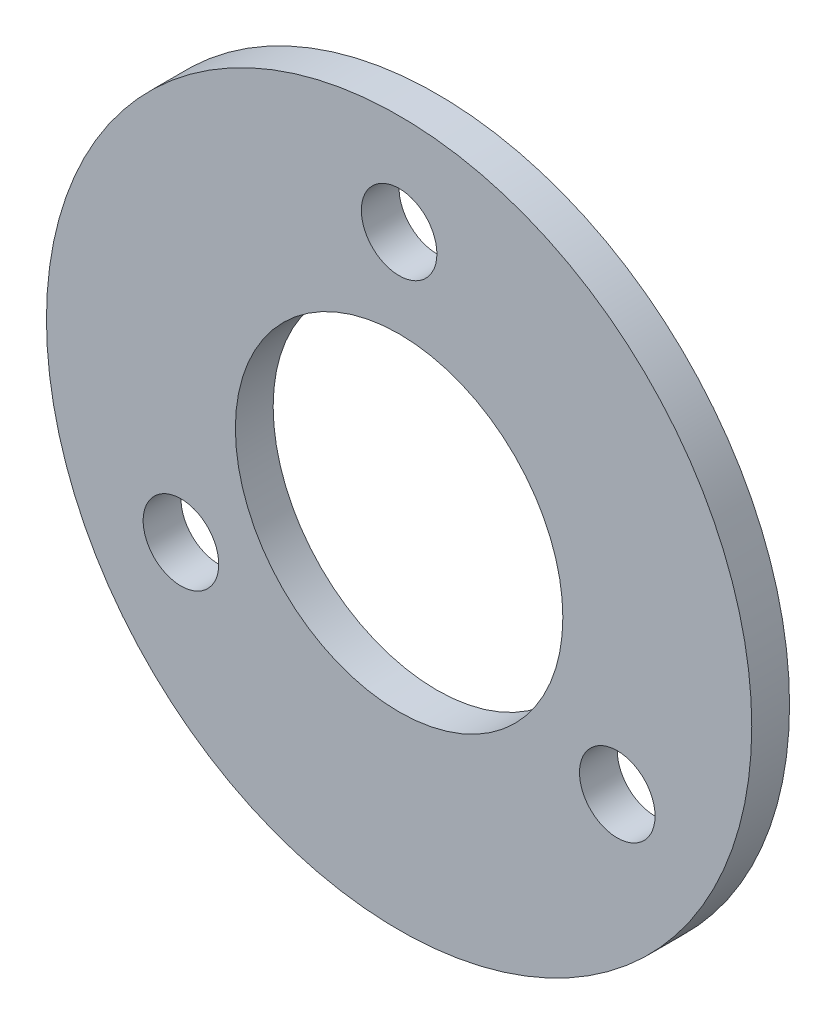
from build123d import *

# Parameters (mm, degrees)
ESBO_O1_R                = 14
ESBO_O1_R_2              = 1.5
ESBO_O1_R_3              = 6.5
RESSALTO_EXTRUS_O1_DEPTH = 1.5


with BuildPart() as part:
    # Esboço1 → Ressalto-extrusão1 (new body)
    with BuildSketch(Plane.XY):
        Circle(ESBO_O1_R)
        with Locations((-8.660254038, -5)):
            Circle(ESBO_O1_R_2, mode=Mode.SUBTRACT)
        with Locations((8.660254038, -5)):
            Circle(ESBO_O1_R_2, mode=Mode.SUBTRACT)
        with Locations((0, 10)):
            Circle(ESBO_O1_R_2, mode=Mode.SUBTRACT)
        Circle(ESBO_O1_R_3, mode=Mode.SUBTRACT)
    extrude(amount=RESSALTO_EXTRUS_O1_DEPTH)


solid = part.part
